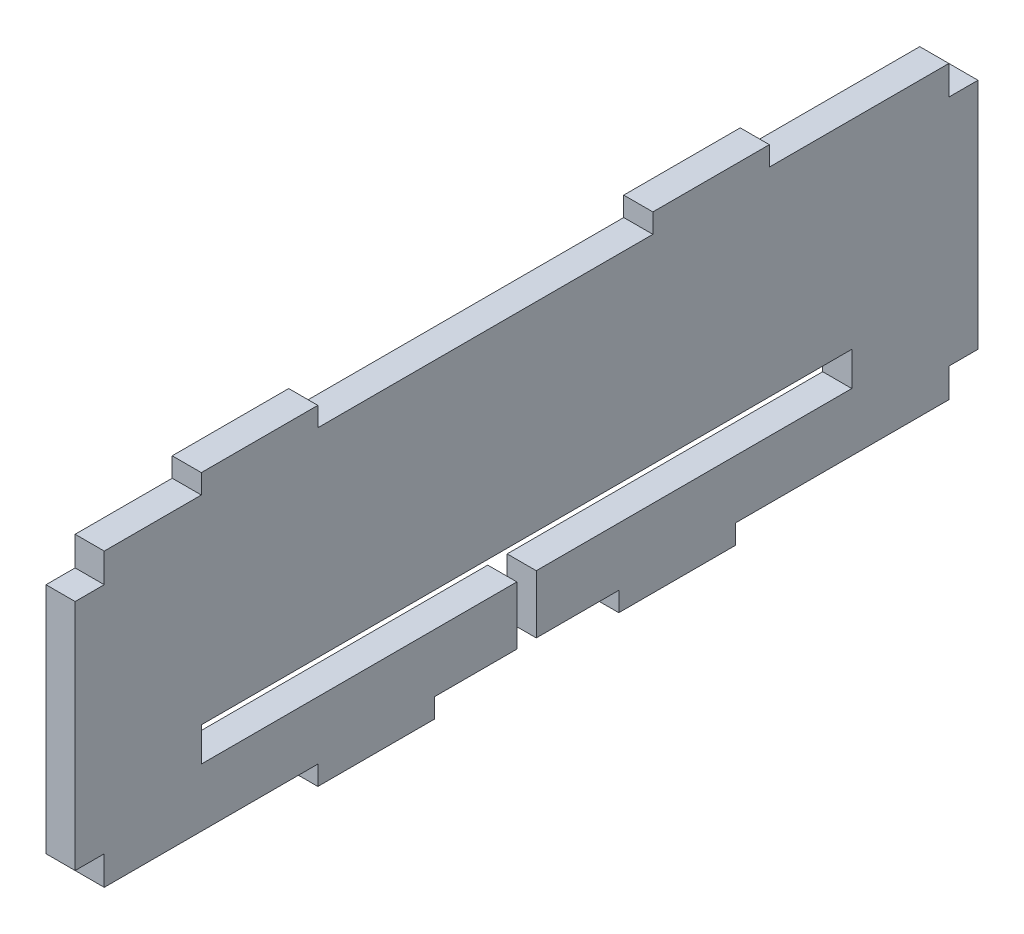
from build123d import *

# Parameters (mm, degrees)
BOSS_EXTRUDE1_DEPTH = 3


with BuildPart() as part:
    # Sketch1 → Boss-Extrude1 (new body)
    with BuildSketch(Plane(origin=(0, 0, 0), x_dir=(0, 0, -1), z_dir=(1, 0, 0))):
        Polygon((25, 2), (25, 0), (37, 0), (37, 2), (45.5, 2), (45.5, 8), (13, 8), (13, 11.5), (80, 11.5), (80, 8), (47.5, 8), (47.5, 2), (56, 2), (56, 0), (68, 0), (68, 2), (90, 2), (90, 5), (93, 5), (93, 29), (90, 29), (90, 32), (71.51, 32), (71.51, 34), (59.51, 34), (59.51, 32), (25, 32), (25, 34), (13, 34), (13, 32), (3, 32), (3, 29), (0, 29), (0, 5), (3, 5), (3, 2), align=None)
    extrude(amount=BOSS_EXTRUDE1_DEPTH)


solid = part.part
